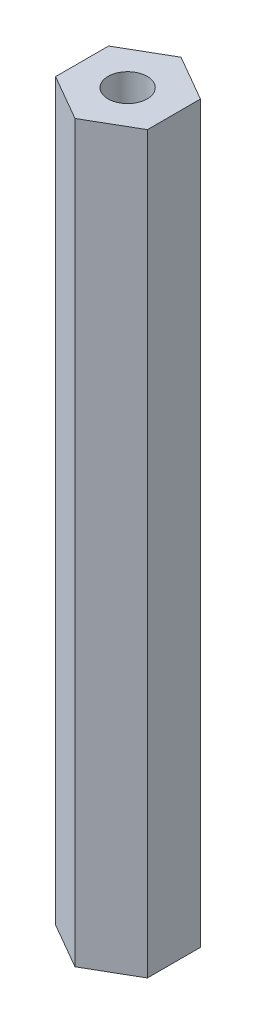
from build123d import *

# Parameters (mm, degrees)
BOSS_EXTRUDE1_DEPTH       = 50.8
F_6_32_TAPPED_HOLE1_D     = 2.7051
F_6_32_TAPPED_HOLE1_DEPTH = 9.398
F_6_32_TAPPED_HOLE1_TIP   = 0.81269403
F_6_32_TAPPED_HOLE2_D     = 2.7051
F_6_32_TAPPED_HOLE2_DEPTH = 9.398
F_6_32_TAPPED_HOLE2_TIP   = 0.81269403


with BuildPart() as part:
    # Sketch1 → Boss-Extrude1 (new body)
    with BuildSketch(Plane(origin=(0, 0, 0), x_dir=(1, 0, 0), z_dir=(0, 1, 0))):
        Polygon((3.175, 1.833087105), (0, 3.666174209), (-3.175, 1.833087105), (-3.175, -1.833087105), (0, -3.666174209), (3.175, -1.833087105), align=None)
    extrude(amount=BOSS_EXTRUDE1_DEPTH)

    # #6-32 Tapped Hole1
    with Locations(Plane(origin=(0, 50.8, 0), x_dir=(-1, 0, 0), z_dir=(0, 1, 0))):
        with Locations((0.023544291, 0.002414528)):
            Hole(F_6_32_TAPPED_HOLE1_D / 2, depth=F_6_32_TAPPED_HOLE1_DEPTH)
            with Locations((0, 0, -(F_6_32_TAPPED_HOLE1_DEPTH + F_6_32_TAPPED_HOLE1_TIP / 2))):  # 118° drill point
                Cone(0, F_6_32_TAPPED_HOLE1_D / 2, F_6_32_TAPPED_HOLE1_TIP, mode=Mode.SUBTRACT)

    # #6-32 Tapped Hole2
    with Locations(Plane.XZ):
        with Locations((0.021072049, 0.073538109)):
            Hole(F_6_32_TAPPED_HOLE2_D / 2, depth=F_6_32_TAPPED_HOLE2_DEPTH)
            with Locations((0, 0, -(F_6_32_TAPPED_HOLE2_DEPTH + F_6_32_TAPPED_HOLE2_TIP / 2))):  # 118° drill point
                Cone(0, F_6_32_TAPPED_HOLE2_D / 2, F_6_32_TAPPED_HOLE2_TIP, mode=Mode.SUBTRACT)


solid = part.part
